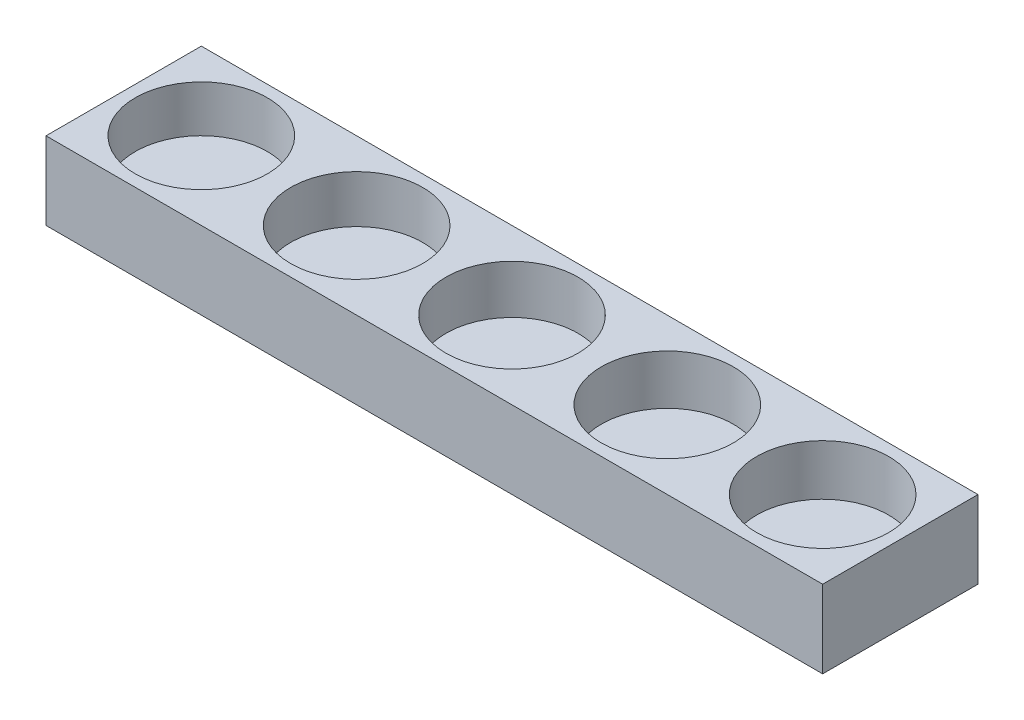
from build123d import *

# Parameters (mm, degrees)
SKETCH1_W           = 150
SKETCH1_H           = 30
SKETCH1_R           = 5
BOSS_EXTRUDE1_DEPTH = 5
SKETCH2_W           = 150
SKETCH2_H           = 30
BOSS_EXTRUDE2_DEPTH = 10
SKETCH3_R           = 12.75
CUT_EXTRUDE1_DEPTH  = 9
SKETCH3_3_R         = 12.75
CUT_EXTRUDE2_DEPTH  = 9.2
SKETCH3_4_R         = 12.75
CUT_EXTRUDE3_DEPTH  = 9.4
SKETCH3_5_R         = 12.75
CUT_EXTRUDE4_DEPTH  = 9.6
SKETCH3_6_R         = 12.75
CUT_EXTRUDE5_DEPTH  = 9.8


with BuildPart() as part:
    # Sketch1 → Boss-Extrude1 (new body)
    with BuildSketch(Plane(origin=(0, 0, 0), x_dir=(1, 0, 0), z_dir=(0, 1, 0))):
        Rectangle(SKETCH1_W, SKETCH1_H)
        with Locations(Location((-60, 0, 0), (0, 0, 270))):
            Circle(SKETCH1_R, mode=Mode.SUBTRACT)
        with Locations(Location((-30, 0, 0), (0, 0, 270))):
            Circle(SKETCH1_R, mode=Mode.SUBTRACT)
        with Locations(Location((0, 0, 0), (0, 0, 270))):
            Circle(SKETCH1_R, mode=Mode.SUBTRACT)
        with Locations(Location((30, 0, 0), (0, 0, 270))):
            Circle(SKETCH1_R, mode=Mode.SUBTRACT)
        with Locations(Location((60, 0, 0), (0, 0, 270))):
            Circle(SKETCH1_R, mode=Mode.SUBTRACT)
    extrude(amount=BOSS_EXTRUDE1_DEPTH)

    # Sketch2 → Boss-Extrude2 (add)
    with BuildSketch(Plane(origin=(0, 5, 0), x_dir=(1, 0, 0), z_dir=(0, 1, 0))):
        Rectangle(SKETCH2_W, SKETCH2_H)
    extrude(amount=BOSS_EXTRUDE2_DEPTH)

    # Sketch3 → Cut-Extrude1 (cut)
    with BuildSketch(Plane(origin=(0, 15, 0), x_dir=(1, 0, 0), z_dir=(0, 1, 0))):
        with Locations(Location((-60, 0, 0), (0, 0, 270))):
            Circle(SKETCH3_R)
    extrude(amount=-CUT_EXTRUDE1_DEPTH, mode=Mode.SUBTRACT)

    # Sketch3<3> → Cut-Extrude2 (cut)
    with BuildSketch(Plane(origin=(0, 15, 0), x_dir=(1, 0, 0), z_dir=(0, 1, 0))):
        with Locations(Location((-30, 0, 0), (0, 0, 270))):
            Circle(SKETCH3_3_R)
    extrude(amount=-CUT_EXTRUDE2_DEPTH, mode=Mode.SUBTRACT)

    # Sketch3<4> → Cut-Extrude3 (cut)
    with BuildSketch(Plane(origin=(0, 15, 0), x_dir=(1, 0, 0), z_dir=(0, 1, 0))):
        with Locations(Location((0, 0, 0), (0, 0, 270))):
            Circle(SKETCH3_4_R)
    extrude(amount=-CUT_EXTRUDE3_DEPTH, mode=Mode.SUBTRACT)

    # Sketch3<5> → Cut-Extrude4 (cut)
    with BuildSketch(Plane(origin=(0, 15, 0), x_dir=(1, 0, 0), z_dir=(0, 1, 0))):
        with Locations(Location((30, 0, 0), (0, 0, 270))):
            Circle(SKETCH3_5_R)
    extrude(amount=-CUT_EXTRUDE4_DEPTH, mode=Mode.SUBTRACT)

    # Sketch3<6> → Cut-Extrude5 (cut)
    with BuildSketch(Plane(origin=(0, 15, 0), x_dir=(1, 0, 0), z_dir=(0, 1, 0))):
        with Locations(Location((60, 0, 0), (0, 0, 270))):
            Circle(SKETCH3_6_R)
    extrude(amount=-CUT_EXTRUDE5_DEPTH, mode=Mode.SUBTRACT)


solid = part.part
